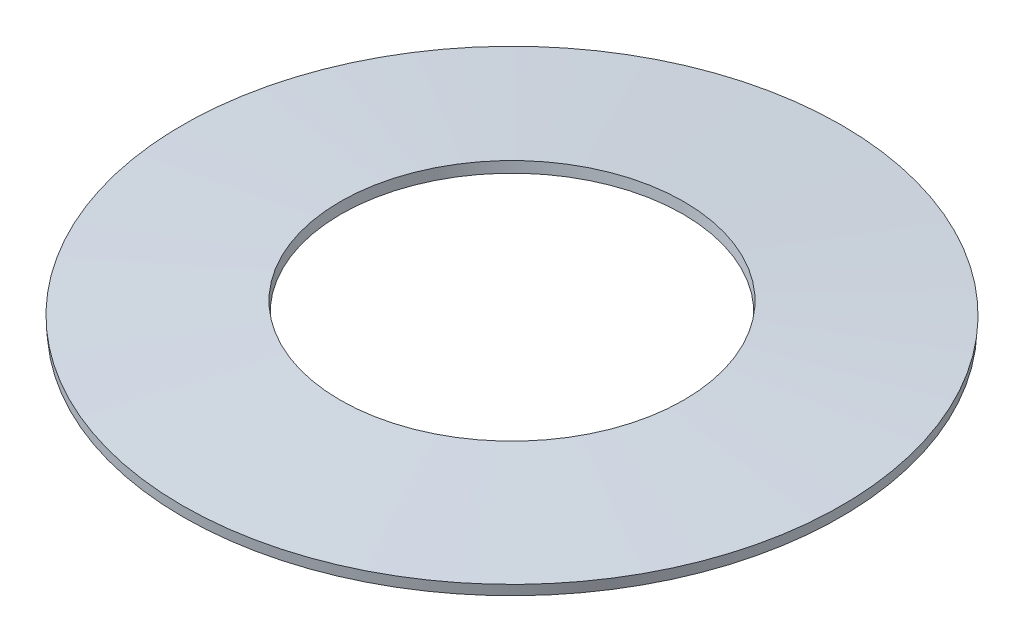
from build123d import *


with BuildPart() as part:
    # Sketch1 → Revolve1 (revolve)
    with BuildSketch(Plane.XY, mode=Mode.PRIVATE) as revolve1_sk:
        Polygon((7.880170206, 0), (4.1, 0.300787682), (4.119829794, 0.55), (7.9, 0.249212318), align=None)
    revolve(revolve1_sk.sketch.rotate(Axis((0, 0, 0), (0, 1, 0)), 90), axis=Axis((0, 0, 0), (0, 1, 0)))


solid = part.part
